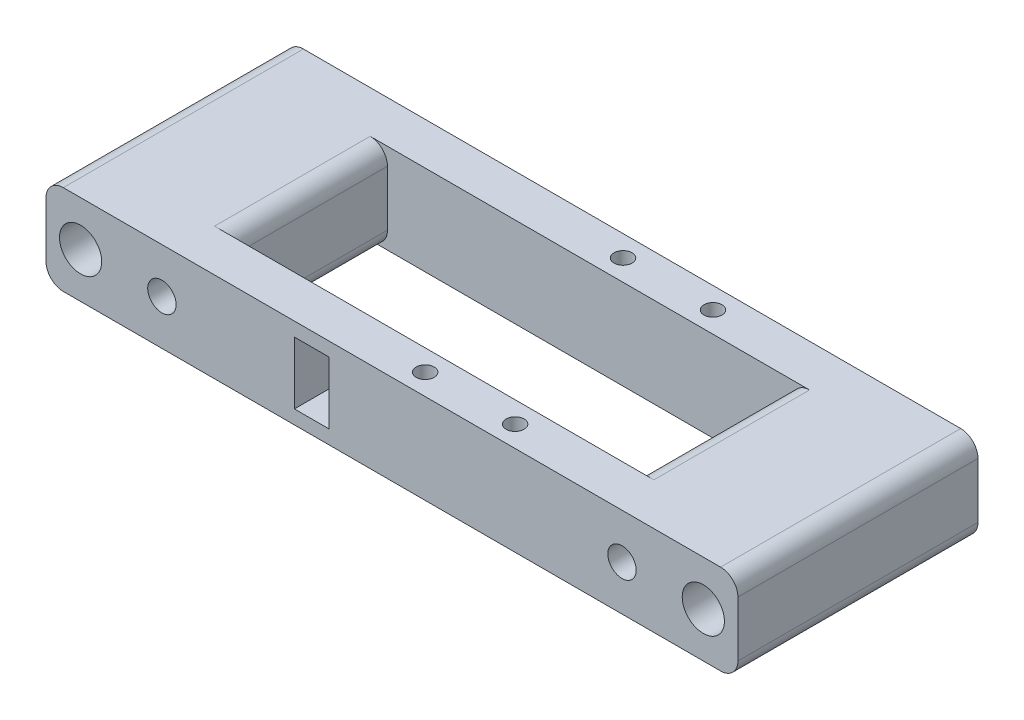
from build123d import *

# Parameters (mm, degrees)
SKETCH1_W           = 100
SKETCH1_H           = 26
SKETCH1_R           = 6.1
SKETCH1_R_2         = 4.1
BOSS_EXTRUDE1_DEPTH = 40
SKETCH2_W           = 100
SKETCH2_H           = 26
BOSS_EXTRUDE2_DEPTH = 29.4
CUT_EXTRUDE1_REACH  = 112.797
SKETCH3_W           = 58.5
SKETCH3_H           = 45
SKETCH4_R           = 2.6
CUT_EXTRUDE2_DEPTH  = 111.797111876
CUT_EXTRUDE3_DEPTH  = 4
SKETCH6_W           = 10
SKETCH6_H           = 18
CUT_EXTRUDE4_DEPTH  = 12.2
FILLET1_R           = 5


with BuildPart() as part:
    # Sketch1 → Boss-Extrude1 (new body)
    with BuildSketch(Plane.XY):
        with Locations((-50, 13)):
            Rectangle(SKETCH1_W, SKETCH1_H)
        with Locations((-90, 13)):
            Circle(SKETCH1_R, mode=Mode.SUBTRACT)
        with Locations((-66.5, 13)):
            Circle(SKETCH1_R_2, mode=Mode.SUBTRACT)
    boss_extrude1 = extrude(amount=BOSS_EXTRUDE1_DEPTH)

    # Sketch2 → Boss-Extrude2 (add)
    with BuildSketch(Plane(origin=(0, 0, 0), x_dir=(-1, 0, 0), z_dir=(0, 0, -1))):
        with Locations((50, 13)):
            Rectangle(SKETCH2_W, SKETCH2_H)
    boss_extrude2 = extrude(amount=BOSS_EXTRUDE2_DEPTH)

    # Sketch3 → Cut-Extrude1 (cut, up to next)
    with BuildSketch(Plane(origin=(0, 26, 0), x_dir=(1, 0, 0), z_dir=(0, 1, 0)), mode=Mode.PRIVATE) as cut_extrude1_sk1:
        with Locations((-29.25, -5.3)):
            Rectangle(SKETCH3_W, SKETCH3_H)
    cut_extrude1_tool1 = extrude(cut_extrude1_sk1.sketch, amount=-CUT_EXTRUDE1_REACH, mode=Mode.PRIVATE) & part.part
    cut_extrude1 = cut_extrude1_tool1.solids().sort_by_distance((-29.25, 26, 5.3))[0]
    add(cut_extrude1, mode=Mode.SUBTRACT)

    # Mirror2: Boss-Extrude1, Boss-Extrude2, Cut-Extrude1 across plane
    add(boss_extrude1.mirror(Plane(origin=(0, 0, 40), x_dir=(0, 0, 1), z_dir=(-1, 0, 0))))
    add(boss_extrude2.mirror(Plane(origin=(0, 0, 40), x_dir=(0, 0, 1), z_dir=(-1, 0, 0))))
    add(cut_extrude1.mirror(Plane(origin=(0, 0, 40), x_dir=(0, 0, 1), z_dir=(-1, 0, 0))), mode=Mode.SUBTRACT)

    # Sketch4 → Cut-Extrude2 (cut, through all)
    with BuildSketch(Plane(origin=(0, 26, 0), x_dir=(1, 0, 0), z_dir=(0, 1, 0))):
        with Locations(Location((3.5, 23.3, 0), (0, 0, 180))):
            Circle(SKETCH4_R)
        with Locations(Location((29.5, 23.3, 0), (0, 0, 180))):
            Circle(SKETCH4_R)
    cut_extrude2 = extrude(amount=-CUT_EXTRUDE2_DEPTH, mode=Mode.SUBTRACT)

    # Sketch5 → Cut-Extrude3 (cut)
    with BuildSketch(Plane.XZ):
        Polygon((34.234272207, -23.3), (31.867136104, -19.2), (27.132863896, -19.2), (24.765727793, -23.3), (27.132863896, -27.4), (31.867136104, -27.4), align=None)
        Polygon((-1.234272207, -23.3), (1.132863896, -27.4), (5.867136104, -27.4), (8.234272207, -23.3), (5.867136104, -19.2), (1.132863896, -19.2), align=None)
    cut_extrude3 = extrude(amount=-CUT_EXTRUDE3_DEPTH, mode=Mode.SUBTRACT)

    # Mirror3: Cut-Extrude2, Cut-Extrude3 across plane
    add(cut_extrude2.mirror(Plane.XY.offset(5.3)), mode=Mode.SUBTRACT)
    add(cut_extrude3.mirror(Plane.XY.offset(5.3)), mode=Mode.SUBTRACT)

    # Sketch6 → Cut-Extrude4 (cut)
    with BuildSketch(Plane.XY.offset(40)):
        with Locations((-23.2, 13)):
            Rectangle(SKETCH6_W, SKETCH6_H)
    extrude(amount=-CUT_EXTRUDE4_DEPTH, mode=Mode.SUBTRACT)

    # Fillet1
    fillet1_edges = [part.edges().sort_by_distance(p)[0] for p in [
        (-58.5, 26, 5.3),
        (-58.5, 0, 5.3),
        (100, 0, 5.3),
        (100, 26, 5.3),
        (-100, 0, 5.3),
        (-100, 26, 5.3),
        (58.5, 0, 5.3),
        (58.5, 26, 5.3),
    ]]
    fillet(fillet1_edges, radius=FILLET1_R)


solid = part.part
